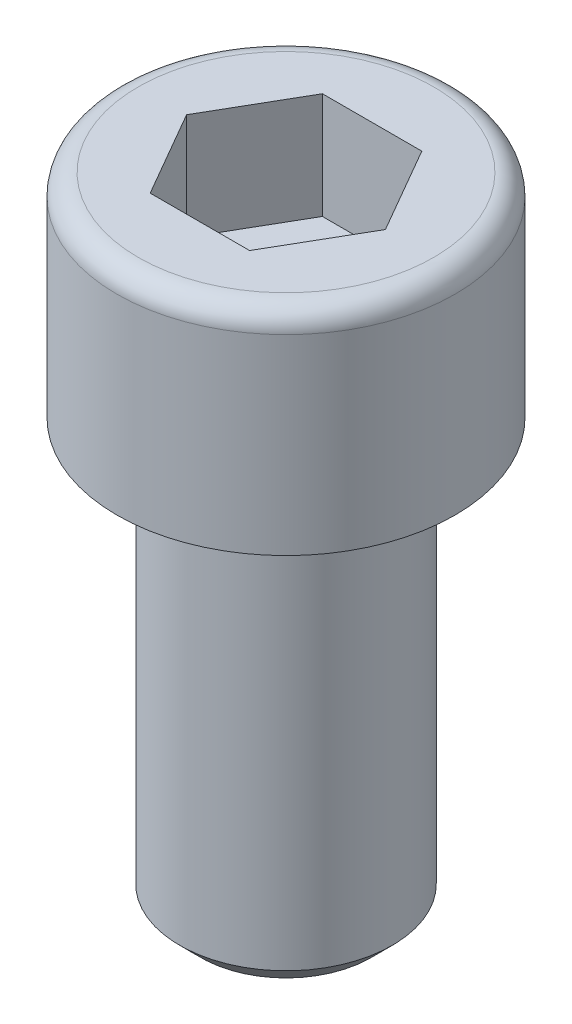
from build123d import *

# Parameters (mm, degrees)
ESQUISSE1_W             = 7.95
ESQUISSE1_H             = 10
ESQUISSE2_R             = 5
BOSS_EXTRU_1_DEPTH      = 20
ENL_V_MAT_EXTRU_1_DEPTH = 5
CHANFREIN1_SIZE         = 1
CONG_1_R                = 1


with BuildPart() as part:
    # Esquisse1 → Révolution1 (revolve)
    with BuildSketch(Plane.XY, mode=Mode.PRIVATE) as r_volution1_sk:
        with Locations((3.975, 5)):
            Rectangle(ESQUISSE1_W, ESQUISSE1_H)
    revolve(r_volution1_sk.sketch.rotate(Axis((0, 10, 0), (0, -1, 0)), 270), axis=Axis((0, 10, 0), (0, -1, 0)))

    # Esquisse2 → Boss.-Extru.1 (add)
    with BuildSketch(Plane.XZ):
        with Locations(Location((0, 0, 0), (0, 0, 270))):
            Circle(ESQUISSE2_R)
    extrude(amount=BOSS_EXTRU_1_DEPTH)

    # Esquisse3 → Enlèv. mat.-Extru.1 (cut)
    with BuildSketch(Plane(origin=(0, 10, 0), x_dir=(-1, 0, 0), z_dir=(0, 1, 0))):
        Polygon((2.33826859, 4.05), (-2.33826859, 4.05), (-4.67653718, 0), (-2.33826859, -4.05), (2.33826859, -4.05), (4.67653718, 0), align=None)
    extrude(amount=-ENL_V_MAT_EXTRU_1_DEPTH, mode=Mode.SUBTRACT)

    # Chanfrein1
    chanfrein1_edges = [part.edges().sort_by_distance(p)[0] for p in [
        (0, -20, 5),
    ]]
    chamfer(chanfrein1_edges, length=CHANFREIN1_SIZE)

    # Congé1
    cong_1_edges = [part.edges().sort_by_distance(p)[0] for p in [
        (0, 10, 7.95),
    ]]
    fillet(cong_1_edges, radius=CONG_1_R)


solid = part.part
